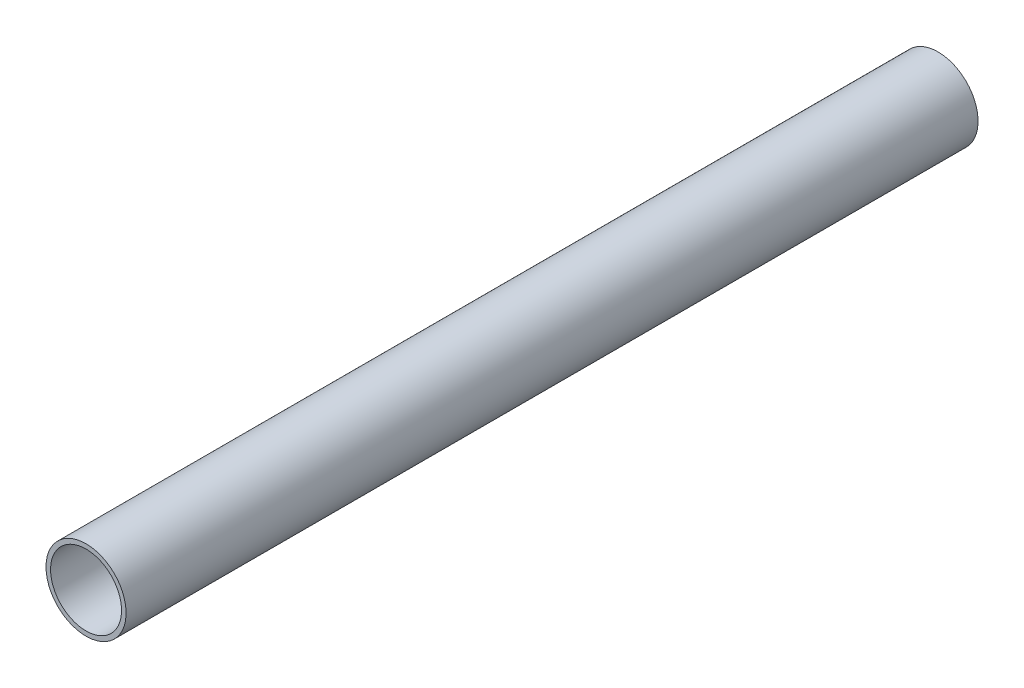
from build123d import *

# Parameters (mm, degrees)
BOSS_EXTRUDE1_DEPTH      = 152.4
BOSS_EXTRUDE1_DEPTH_BACK = 152.4
SKETCH3_R                = 14.3256
SKETCH3_R_2              = 12.7


with BuildPart() as part:
    # Sketch3 → Boss-Extrude1 (new, two sides: drawn at the far end of the back side and taken through both)
    with BuildSketch(Plane.XY.offset(-BOSS_EXTRUDE1_DEPTH_BACK)):
        with Locations(Location((0, 0, 0), (0, 0, 180))):
            Circle(SKETCH3_R)
        with Locations(Location((0, 0, 0), (0, 0, 180))):
            Circle(SKETCH3_R_2, mode=Mode.SUBTRACT)
    extrude(amount=BOSS_EXTRUDE1_DEPTH + BOSS_EXTRUDE1_DEPTH_BACK)


solid = part.part
